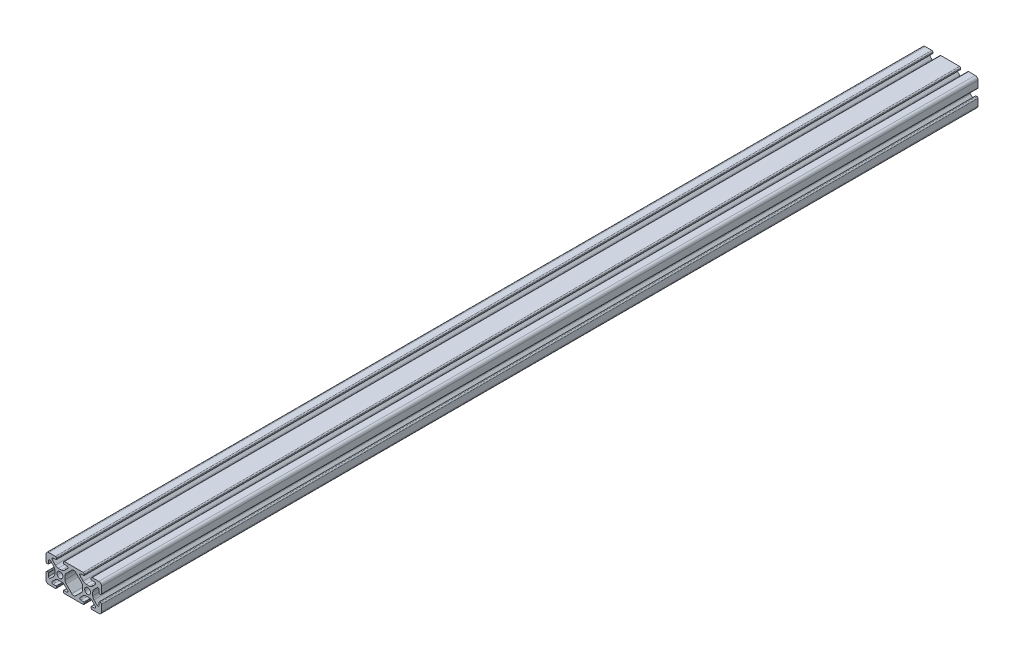
from build123d import *

# Parameters (mm, degrees)
ESQUISSE1_R        = 2.15
BOSS_EXTRU_1_DEPTH = 315.5


with BuildPart() as part:
    # Esquisse1 → Boss.-Extru.1 (new, symmetric)
    with BuildSketch(Plane(origin=(0, 0, 0), x_dir=(-1, 0, 0), z_dir=(0, 0, -1))):
        with BuildLine():
            Line((-40, 6.7), (-40, 2))
            ThreePointArc((-40, 2), (-39.414213562, 0.585786438), (-38, 0))
            Line((-38, 0), (-33.3, 0))
            ThreePointArc((-33.3, 0), (-32.734314575, 0.234314575), (-32.5, 0.8))
            Line((-32.5, 0.8), (-32.5, 1.5))
            ThreePointArc((-32.5, 1.5), (-32.587867966, 1.712132034), (-32.8, 1.8))
            Line((-32.8, 1.8), (-34.918424061, 1.8))
            ThreePointArc((-34.918424061, 1.8), (-35.686700051, 2.313345604), (-35.506437047, 3.219588924))
            Line((-35.506437047, 3.219588924), (-33.254705627, 5.471320344))
            ThreePointArc((-33.254705627, 5.471320344), (-32.281435581, 6.121638598), (-31.133385284, 6.35))
            Line((-31.133385284, 6.35), (-28.866614716, 6.35))
            ThreePointArc((-28.866614716, 6.35), (-27.718564419, 6.121638598), (-26.745294373, 5.471320344))
            Line((-26.745294373, 5.471320344), (-24.493562953, 3.219588924))
            ThreePointArc((-24.493562953, 3.219588924), (-24.313299949, 2.313345604), (-25.081575939, 1.8))
            Line((-25.081575939, 1.8), (-27.2, 1.8))
            ThreePointArc((-27.2, 1.8), (-27.412132034, 1.712132034), (-27.5, 1.5))
            Line((-27.5, 1.5), (-27.5, 0.8))
            ThreePointArc((-27.5, 0.8), (-27.265685425, 0.234314575), (-26.7, 0))
            Line((-26.7, 0), (-13.3, 0))
            ThreePointArc((-13.3, 0), (-12.734314575, 0.234314575), (-12.5, 0.8))
            Line((-12.5, 0.8), (-12.5, 1.5))
            ThreePointArc((-12.5, 1.5), (-12.587867966, 1.712132034), (-12.8, 1.8))
            Line((-12.8, 1.8), (-14.918424061, 1.8))
            ThreePointArc((-14.918424061, 1.8), (-15.686700051, 2.313345604), (-15.506437047, 3.219588924))
            Line((-15.506437047, 3.219588924), (-13.254705627, 5.471320344))
            ThreePointArc((-13.254705627, 5.471320344), (-12.281435581, 6.121638598), (-11.133385284, 6.35))
            Line((-11.133385284, 6.35), (-8.866614716, 6.35))
            ThreePointArc((-8.866614716, 6.35), (-7.718564419, 6.121638598), (-6.745294373, 5.471320344))
            Line((-6.745294373, 5.471320344), (-4.493562953, 3.219588924))
            ThreePointArc((-4.493562953, 3.219588924), (-4.313299949, 2.313345604), (-5.081575939, 1.8))
            Line((-5.081575939, 1.8), (-7.2, 1.8))
            ThreePointArc((-7.2, 1.8), (-7.412132034, 1.712132034), (-7.5, 1.5))
            Line((-7.5, 1.5), (-7.5, 0.8))
            ThreePointArc((-7.5, 0.8), (-7.265685425, 0.234314575), (-6.7, 0))
            Line((-6.7, 0), (-2, 0))
            ThreePointArc((-2, 0), (-0.585786438, 0.585786438), (0, 2))
            Line((0, 2), (0, 6.7))
            ThreePointArc((0, 6.7), (-0.234314575, 7.265685425), (-0.8, 7.5))
            Line((-0.8, 7.5), (-1.5, 7.5))
            ThreePointArc((-1.5, 7.5), (-1.712132034, 7.412132034), (-1.8, 7.2))
            Line((-1.8, 7.2), (-1.8, 5.081575939))
            ThreePointArc((-1.8, 5.081575939), (-2.313345604, 4.313299949), (-3.219588924, 4.493562953))
            Line((-3.219588924, 4.493562953), (-5.471320344, 6.745294373))
            ThreePointArc((-5.471320344, 6.745294373), (-6.121638598, 7.718564419), (-6.35, 8.866614716))
            Line((-6.35, 8.866614716), (-6.35, 11.133385284))
            ThreePointArc((-6.35, 11.133385284), (-6.121638598, 12.281435581), (-5.471320344, 13.254705627))
            Line((-5.471320344, 13.254705627), (-3.219588924, 15.506437047))
            ThreePointArc((-3.219588924, 15.506437047), (-2.313345604, 15.686700051), (-1.8, 14.918424061))
            Line((-1.8, 14.918424061), (-1.8, 12.8))
            ThreePointArc((-1.8, 12.8), (-1.712132034, 12.587867966), (-1.5, 12.5))
            Line((-1.5, 12.5), (-0.8, 12.5))
            ThreePointArc((-0.8, 12.5), (-0.234314575, 12.734314575), (0, 13.3))
            Line((0, 13.3), (0, 18))
            ThreePointArc((0, 18), (-0.585786438, 19.414213562), (-2, 20))
            Line((-2, 20), (-6.7, 20))
            ThreePointArc((-6.7, 20), (-7.265685425, 19.765685425), (-7.5, 19.2))
            Line((-7.5, 19.2), (-7.5, 18.5))
            ThreePointArc((-7.5, 18.5), (-7.412132034, 18.287867966), (-7.2, 18.2))
            Line((-7.2, 18.2), (-5.081575939, 18.2))
            ThreePointArc((-5.081575939, 18.2), (-4.313299949, 17.686654396), (-4.493562953, 16.780411076))
            Line((-4.493562953, 16.780411076), (-6.745294373, 14.528679656))
            ThreePointArc((-6.745294373, 14.528679656), (-7.718564419, 13.878361402), (-8.866614716, 13.65))
            Line((-8.866614716, 13.65), (-11.133385284, 13.65))
            ThreePointArc((-11.133385284, 13.65), (-12.281435581, 13.878361402), (-13.254705627, 14.528679656))
            Line((-13.254705627, 14.528679656), (-15.506437047, 16.780411076))
            ThreePointArc((-15.506437047, 16.780411076), (-15.686700051, 17.686654396), (-14.918424061, 18.2))
            Line((-14.918424061, 18.2), (-12.8, 18.2))
            ThreePointArc((-12.8, 18.2), (-12.587867966, 18.287867966), (-12.5, 18.5))
            Line((-12.5, 18.5), (-12.5, 19.2))
            ThreePointArc((-12.5, 19.2), (-12.734314575, 19.765685425), (-13.3, 20))
            Line((-13.3, 20), (-26.7, 20))
            ThreePointArc((-26.7, 20), (-27.265685425, 19.765685425), (-27.5, 19.2))
            Line((-27.5, 19.2), (-27.5, 18.5))
            ThreePointArc((-27.5, 18.5), (-27.412132034, 18.287867966), (-27.2, 18.2))
            Line((-27.2, 18.2), (-25.081575939, 18.2))
            ThreePointArc((-25.081575939, 18.2), (-24.313299949, 17.686654396), (-24.493562953, 16.780411076))
            Line((-24.493562953, 16.780411076), (-26.745294373, 14.528679656))
            ThreePointArc((-26.745294373, 14.528679656), (-27.718564419, 13.878361402), (-28.866614716, 13.65))
            Line((-28.866614716, 13.65), (-31.133385284, 13.65))
            ThreePointArc((-31.133385284, 13.65), (-32.281435581, 13.878361402), (-33.254705627, 14.528679656))
            Line((-33.254705627, 14.528679656), (-35.506437047, 16.780411076))
            ThreePointArc((-35.506437047, 16.780411076), (-35.686700051, 17.686654396), (-34.918424061, 18.2))
            Line((-34.918424061, 18.2), (-32.8, 18.2))
            ThreePointArc((-32.8, 18.2), (-32.587867966, 18.287867966), (-32.5, 18.5))
            Line((-32.5, 18.5), (-32.5, 19.2))
            ThreePointArc((-32.5, 19.2), (-32.734314575, 19.765685425), (-33.3, 20))
            Line((-33.3, 20), (-38, 20))
            ThreePointArc((-38, 20), (-39.414213562, 19.414213562), (-40, 18))
            Line((-40, 18), (-40, 13.3))
            ThreePointArc((-40, 13.3), (-39.765685425, 12.734314575), (-39.2, 12.5))
            Line((-39.2, 12.5), (-38.5, 12.5))
            ThreePointArc((-38.5, 12.5), (-38.287867966, 12.587867966), (-38.2, 12.8))
            Line((-38.2, 12.8), (-38.2, 14.918424061))
            ThreePointArc((-38.2, 14.918424061), (-37.686654396, 15.686700051), (-36.780411076, 15.506437047))
            Line((-36.780411076, 15.506437047), (-34.528679656, 13.254705627))
            ThreePointArc((-34.528679656, 13.254705627), (-33.878361402, 12.281435581), (-33.65, 11.133385284))
            Line((-33.65, 11.133385284), (-33.65, 8.866614716))
            ThreePointArc((-33.65, 8.866614716), (-33.878361402, 7.718564419), (-34.528679656, 6.745294373))
            Line((-34.528679656, 6.745294373), (-36.780411076, 4.493562953))
            ThreePointArc((-36.780411076, 4.493562953), (-37.686654396, 4.313299949), (-38.2, 5.081575939))
            Line((-38.2, 5.081575939), (-38.2, 7.2))
            ThreePointArc((-38.2, 7.2), (-38.287867966, 7.412132034), (-38.5, 7.5))
            Line((-38.5, 7.5), (-39.2, 7.5))
            ThreePointArc((-39.2, 7.5), (-39.765685425, 7.265685425), (-40, 6.7))
        make_face()
        with Locations(Location((-10, 10, 0), (0, 0, 180))):
            Circle(ESQUISSE1_R, mode=Mode.SUBTRACT)
        with Locations(Location((-30, 10, 0), (0, 0, 180))):
            Circle(ESQUISSE1_R, mode=Mode.SUBTRACT)
        with BuildLine():
            Line((-18.585786174, 17.312993861), (-14.528681072, 13.255889759))
            ThreePointArc((-14.528681072, 13.255889759), (-13.878362627, 12.282619622), (-13.650001154, 11.134569154))
            Line((-13.650001154, 11.134569154), (-13.650001154, 8.865431094))
            ThreePointArc((-13.650001154, 8.865431094), (-13.878362476, 7.717381202), (-14.5286805, 6.7441115))
            Line((-14.5286805, 6.7441115), (-18.585786, 2.687006))
            ThreePointArc((-18.585786, 2.687006), (-19.999999562, 2.101219562), (-21.414213125, 2.687006))
            Line((-21.414213125, 2.687006), (-25.471320125, 6.744113))
            ThreePointArc((-25.471320125, 6.744113), (-26.121638379, 7.717383046), (-26.349999781, 8.865433344))
            Line((-26.349999781, 8.865433344), (-26.349999781, 11.134567344))
            ThreePointArc((-26.349999781, 11.134567344), (-26.121638308, 12.282617811), (-25.471319863, 13.255887949))
            Line((-25.471319863, 13.255887949), (-21.41421295, 17.312993861))
            ThreePointArc((-21.41421295, 17.312993861), (-19.999999562, 17.898780125), (-18.585786174, 17.312993861))
        make_face(mode=Mode.SUBTRACT)
    extrude(amount=BOSS_EXTRU_1_DEPTH, both=True)


solid = part.part
